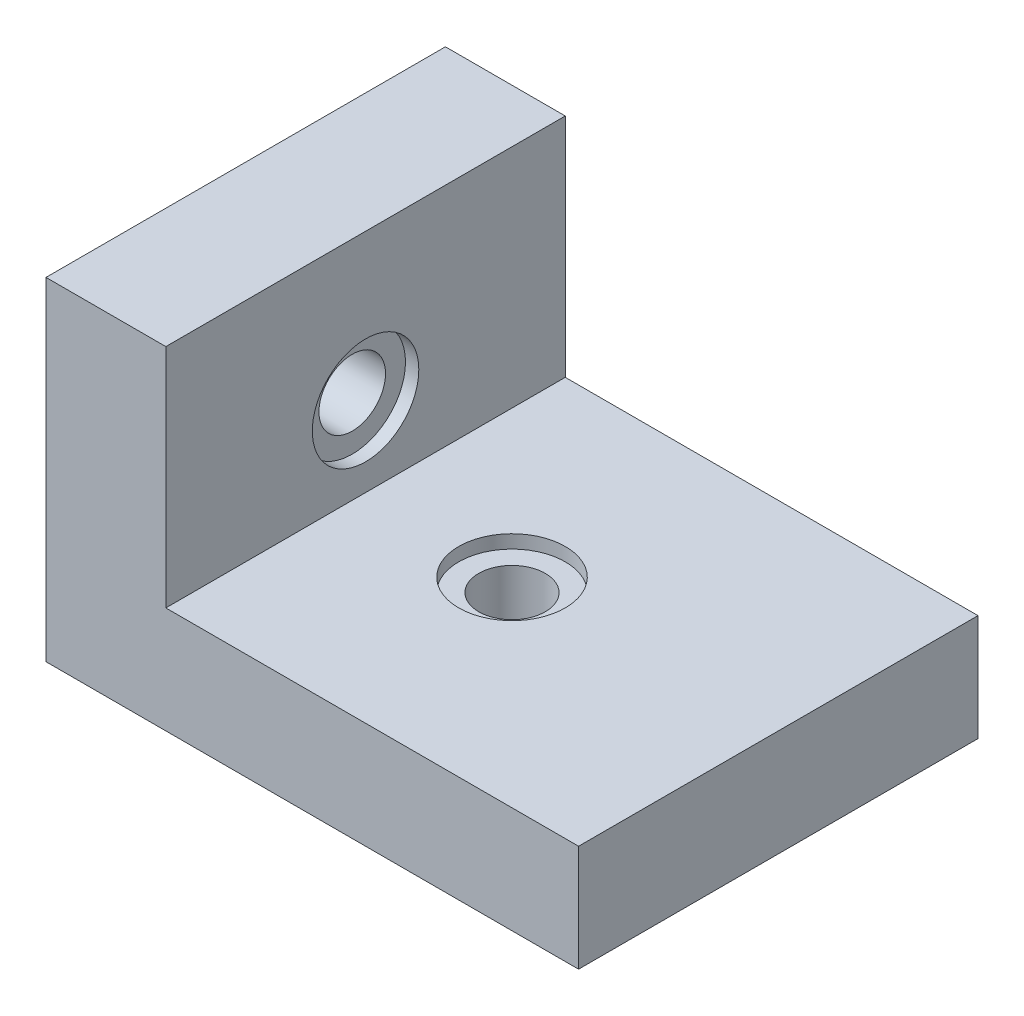
from build123d import *

# Parameters (mm, degrees)
SKETCH_3_W          = 40
SKETCH_3_H          = 30
SKETCH_3_R          = 2.5
EXTRUDE_3_DEPTH     = 8
SKETCH_4_W          = 30
SKETCH_4_H          = 25
SKETCH_4_R          = 2.5
EXTRUDE_4_DEPTH     = 9
SKETCH_5_R          = 4
CUT_EXTRUDE_1_DEPTH = 1
SKETCH_6_R          = 4
CUT_EXTRUDE_2_DEPTH = 1


with BuildPart() as part:
    # 스케치3 → 보스-돌출3 (new body)
    with BuildSketch(Plane(origin=(0, 0, 0), x_dir=(1, 0, 0), z_dir=(0, 1, 0))):
        with Locations((20, -15)):
            Rectangle(SKETCH_3_W, SKETCH_3_H)
        with Locations(Location((20, -15, 0), (0, 0, 270))):
            Circle(SKETCH_3_R, mode=Mode.SUBTRACT)
    extrude(amount=EXTRUDE_3_DEPTH)

    # 스케치4 → 보스-돌출4 (add)
    with BuildSketch(Plane(origin=(0, 0, 0), x_dir=(0, 0, -1), z_dir=(1, 0, 0))):
        with Locations((-15, 12.5)):
            Rectangle(SKETCH_4_W, SKETCH_4_H)
        with Locations((-15, 14)):
            Circle(SKETCH_4_R, mode=Mode.SUBTRACT)
    extrude(amount=EXTRUDE_4_DEPTH)

    # 스케치5 → 컷-돌출1 (cut)
    with BuildSketch(Plane(origin=(0, 8, 0), x_dir=(1, 0, 0), z_dir=(0, 1, 0))):
        with Locations(Location((20, -15, 0), (0, 0, 270))):
            Circle(SKETCH_5_R)
    extrude(amount=-CUT_EXTRUDE_1_DEPTH, mode=Mode.SUBTRACT)

    # 스케치6 → 컷-돌출2 (cut)
    with BuildSketch(Plane(origin=(9, 0, 0), x_dir=(0, 0, -1), z_dir=(1, 0, 0))):
        with Locations((-15, 14)):
            Circle(SKETCH_6_R)
    extrude(amount=-CUT_EXTRUDE_2_DEPTH, mode=Mode.SUBTRACT)


solid = part.part
